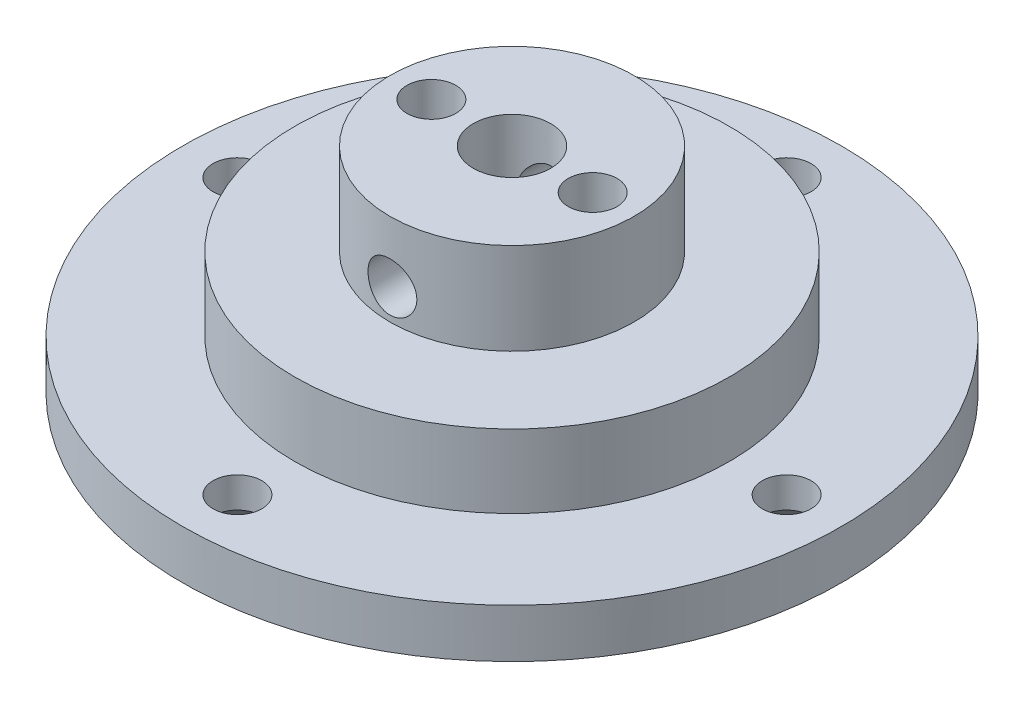
from build123d import *

# Parameters (mm, degrees)
SKETCH_1_R          = 27
SKETCH_1_R_2        = 3.175
EXTRUDE_1_DEPTH     = 16
CUT_EXTRUDE_START   = -7.5
SKETCH_2_R          = 27
SKETCH_2_R_2        = 10
CUT_EXTRUDE_1_DEPTH = 7.5
SKETCH_3_R          = 15
CUT_EXTRUDE_2_DEPTH = 6
CUT_EXTRUDE_START_2 = -6
SKETCH_4_R          = 27
SKETCH_4_R_2        = 17.8
CUT_EXTRUDE_3_DEPTH = 6
SKETCH_5_R          = 2
CUT_EXTRUDE_4_DEPTH = 16.25
EXTRUDE_START       = 1.5
SKETCH_6_R          = 27
SKETCH_6_R_2        = 15
EXTRUDE_5_DEPTH     = 1.5
SKETCH_7_R          = 2
CUT_EXTRUDE_6_DEPTH = 41.500000033
CHAMFER_1_SIZE      = 1.5
SKETCH_8_R          = 2
CUT_EXTRUDE_7_DEPTH = 43.002976085


with BuildPart() as part:
    # Эскиз1 → Вытянуть1 (new body)
    with BuildSketch(Plane(origin=(0, 0, 0), x_dir=(1, 0, 0), z_dir=(0, 1, 0))):
        with Locations(Location((0, 0, 0), (0, 0, 270))):
            Circle(SKETCH_1_R)
        with Locations(Location((0, 0, 0), (0, 0, 270))):
            Circle(SKETCH_1_R_2, mode=Mode.SUBTRACT)
    extrude(amount=EXTRUDE_1_DEPTH)

    # Эскиз2 → Вырез-Вытянуть1 (cut)
    with BuildSketch(Plane(origin=(0, 16, 0), x_dir=(1, 0, 0), z_dir=(0, 1, 0)).offset(CUT_EXTRUDE_START)):
        with Locations(Location((0, 0, 0), (0, 0, 270))):
            Circle(SKETCH_2_R)
        with Locations(Location((0, 0, 0), (0, 0, 270))):
            Circle(SKETCH_2_R_2, mode=Mode.SUBTRACT)
    extrude(amount=CUT_EXTRUDE_1_DEPTH, mode=Mode.SUBTRACT)

    # Эскиз3 → Вытянуть2 (cut)
    with BuildSketch(Plane.XZ):
        with Locations(Location((0, 0, 0), (0, 0, 270))):
            Circle(SKETCH_3_R)
    extrude(amount=-CUT_EXTRUDE_2_DEPTH, mode=Mode.SUBTRACT)

    # Эскиз4 → Вытянуть3 (cut)
    with BuildSketch(Plane(origin=(0, 8.5, 0), x_dir=(1, 0, 0), z_dir=(0, 1, 0)).offset(CUT_EXTRUDE_START_2)):
        with Locations(Location((0, 0, 0), (0, 0, 270))):
            Circle(SKETCH_4_R)
        with Locations(Location((0, 0, 0), (0, 0, 270))):
            Circle(SKETCH_4_R_2, mode=Mode.SUBTRACT)
    extrude(amount=CUT_EXTRUDE_3_DEPTH, mode=Mode.SUBTRACT)

    # Эскиз5 → Вытянуть4 (cut, symmetric)
    with BuildSketch(Plane.XY):
        with Locations((0, 11)):
            Circle(SKETCH_5_R)
    extrude(amount=CUT_EXTRUDE_4_DEPTH, both=True, mode=Mode.SUBTRACT)

    # Эскиз6 → Вытянуть5 (add)
    with BuildSketch(Plane.XZ.offset(EXTRUDE_START)):
        with Locations(Location((0, 0, 0), (0, 0, 270))):
            Circle(SKETCH_6_R)
        with Locations(Location((0, 0, 0), (0, 0, 270))):
            Circle(SKETCH_6_R_2, mode=Mode.SUBTRACT)
    extrude(amount=-EXTRUDE_5_DEPTH)

    # Эскиз7 → Вытянуть6 (cut, through all)
    with BuildSketch(Plane(origin=(0, 2.5, 0), x_dir=(1, 0, 0), z_dir=(0, 1, 0))):
        with Locations(Location((0, 22.5, 0), (0, 0, 270))):
            Circle(SKETCH_7_R)
        with Locations(Location((22.5, 0, 0), (0, 0, 270))):
            Circle(SKETCH_7_R)
        with Locations(Location((0, -22.5, 0), (0, 0, 270))):
            Circle(SKETCH_7_R)
        with Locations(Location((-22.5, 0, 0), (0, 0, 270))):
            Circle(SKETCH_7_R)
    extrude(amount=-CUT_EXTRUDE_6_DEPTH, mode=Mode.SUBTRACT)

    # Фаска1
    chamfer_1_edges = [part.edges().sort_by_distance(p)[0] for p in [
        (0, -1.5, -24.5),
        (22.5, -1.5, -2),
        (0, -1.5, 20.5),
        (-22.5, -1.5, -2),
    ]]
    chamfer(chamfer_1_edges, length=CHAMFER_1_SIZE)

    # Эскиз8 → Вытянуть7 (cut, through all)
    with BuildSketch(Plane(origin=(0, 16, 0), x_dir=(1, 0, 0), z_dir=(0, 1, 0))):
        with Locations(Location((-6.60744303, 0, 0), (0, 0, 270))):
            Circle(SKETCH_8_R)
        with Locations(Location((6.60744303, 0, 0), (0, 0, 90))):
            Circle(SKETCH_8_R)
    extrude(amount=-CUT_EXTRUDE_7_DEPTH, mode=Mode.SUBTRACT)


solid = part.part
